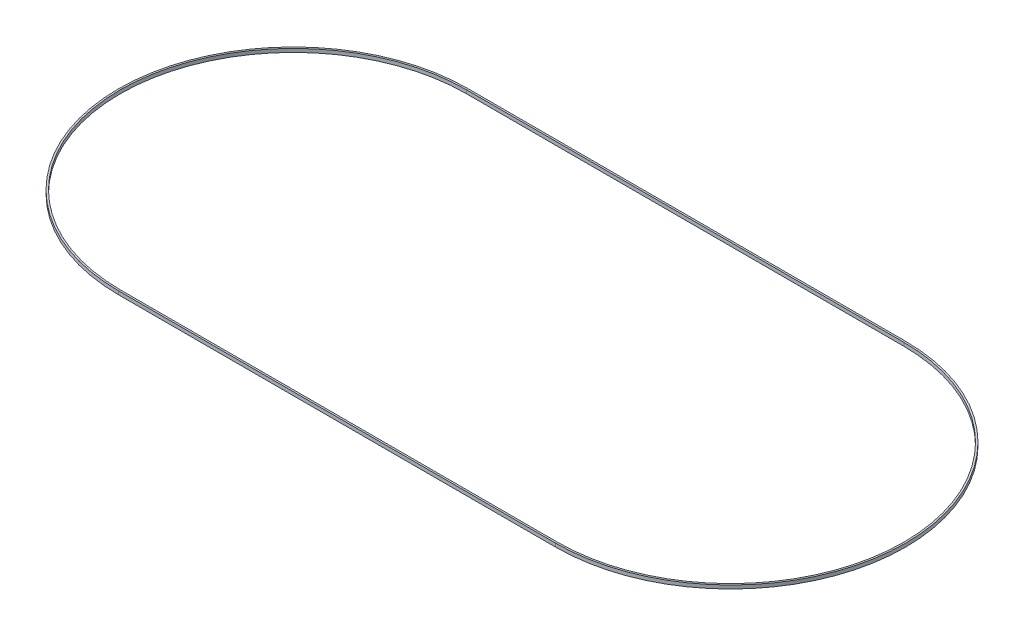
from build123d import *

# Parameters (mm, degrees)
BOSS_EXTRUDE1_DEPTH = 400


with BuildPart() as part:
    # Sketch1 → Boss-Extrude1 (new body)
    with BuildSketch(Plane(origin=(0, 0, 0), x_dir=(1, 0, 0), z_dir=(0, 1, 0))):
        with BuildLine():
            ThreePointArc((25000, 20000), (45000, 0), (25000, -20000))
            Line((25000, -20000), (-25000, -20000))
            ThreePointArc((-25000, -20000), (-45000, 0), (-25000, 20000))
            Line((-25000, 20000), (25000, 20000))
        make_face()
        with BuildLine():
            ThreePointArc((-25000, 19800), (-44800, 0), (-25000, -19800))
            Line((-25000, -19800), (25000, -19800))
            ThreePointArc((25000, -19800), (44800, 0), (25000, 19800))
            Line((25000, 19800), (-25000, 19800))
        make_face(mode=Mode.SUBTRACT)
    extrude(amount=BOSS_EXTRUDE1_DEPTH)


solid = part.part
